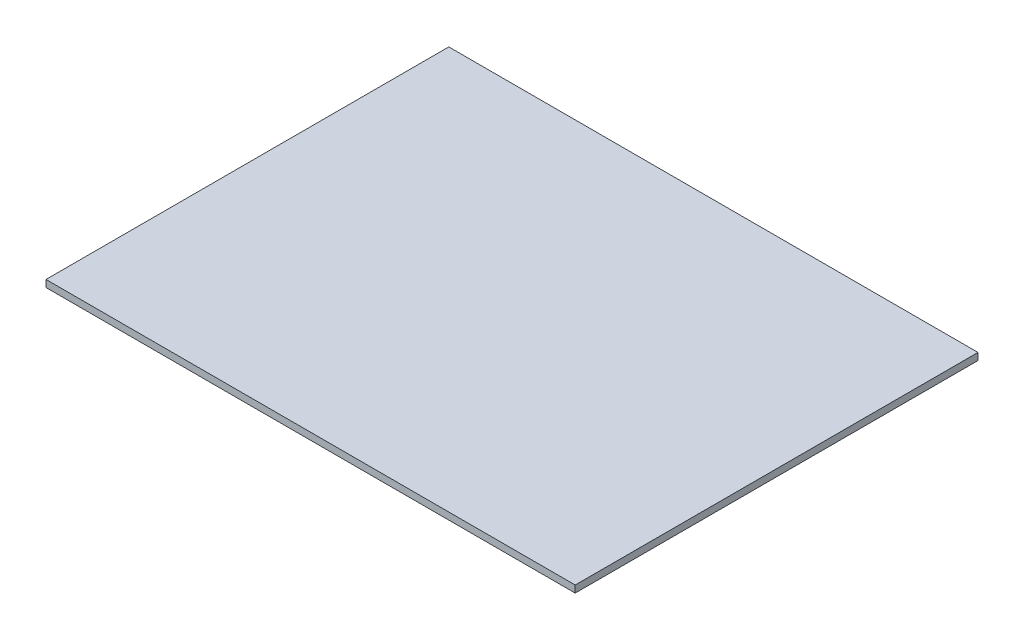
from build123d import *

# Parameters (mm, degrees)
SKETCH1_W           = 150.7
SKETCH1_H           = 114.7
BOSS_EXTRUDE1_DEPTH = 2


with BuildPart() as part:
    # Sketch1 → Boss-Extrude1 (new body)
    with BuildSketch(Plane(origin=(0, 0, 0), x_dir=(1, 0, 0), z_dir=(0, 1, 0))):
        Rectangle(SKETCH1_W, SKETCH1_H)
    extrude(amount=BOSS_EXTRUDE1_DEPTH)


solid = part.part
